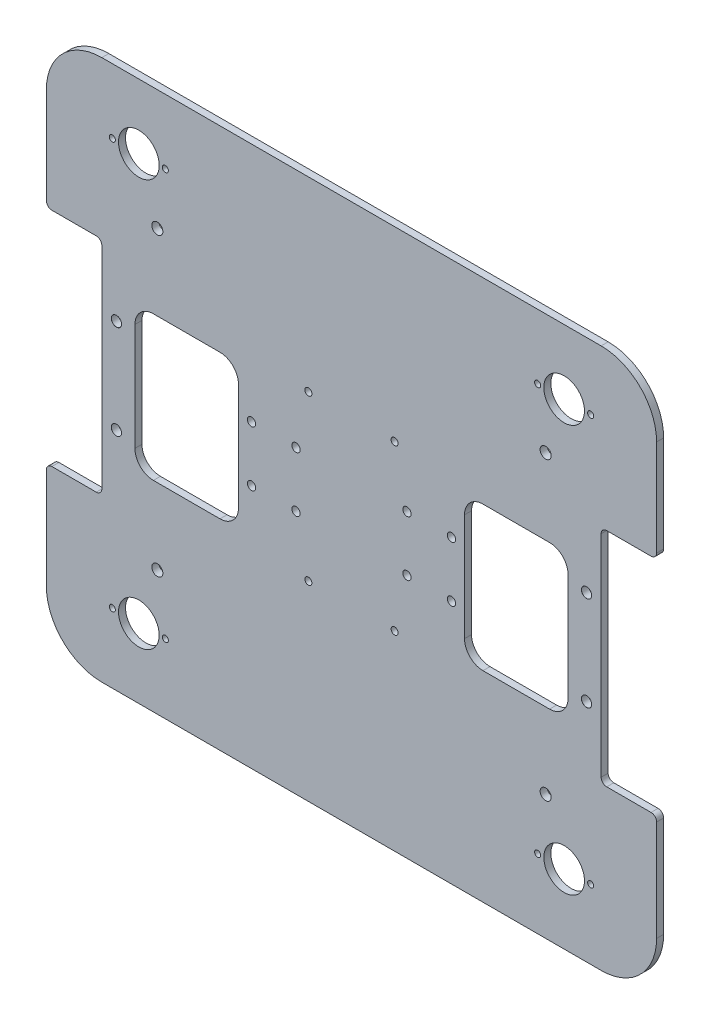
from build123d import *

# Parameters (mm, degrees)
SKETCH2_R                      = 1.65
SKETCH2_R_2                    = 11
SKETCH2_R_3                    = 3
SKETCH2_R_4                    = 1.9
SKETCH2_R_5                    = 2.25
BOSS_EXTRUDE1_DEPTH            = 3.8
M5_CLEARANCE_HOLE1_D           = 5.5
M5_CLEARANCE_HOLE1_CSINK_D     = 5.55
M5_CLEARANCE_HOLE1_CSINK_ANGLE = 90
SKETCH4_R                      = 13.987722527
BOSS_EXTRUDE2_DEPTH            = 0.2


with BuildPart() as part:
    # Sketch2 → Boss-Extrude1 (new body)
    with BuildSketch(Plane.XY):
        with BuildLine():
            Line((165, 63), (165, 115))
            ThreePointArc((165, 115), (156.213203436, 136.213203436), (135, 145))
            Line((135, 145), (71.563974327, 145))
            Line((71.563974327, 145), (-71.563974327, 145))
            Line((-71.563974327, 145), (-135, 145))
            ThreePointArc((-135, 145), (-156.213203436, 136.213203436), (-165, 115))
            Line((-165, 115), (-165, 63))
            ThreePointArc((-165, 63), (-164.121320344, 60.878679656), (-162, 60))
            Line((-162, 60), (-138, 60))
            ThreePointArc((-138, 60), (-135.878679656, 59.121320344), (-135, 57))
            Line((-135, 57), (-135, -57))
            ThreePointArc((-135, -57), (-135.878679656, -59.121320344), (-138, -60))
            Line((-138, -60), (-162, -60))
            ThreePointArc((-162, -60), (-164.121320344, -60.878679656), (-165, -63))
            Line((-165, -63), (-165, -117.5))
            ThreePointArc((-165, -117.5), (-156.213203436, -138.713203436), (-135, -147.5))
            Line((-135, -147.5), (135, -147.5))
            ThreePointArc((135, -147.5), (156.213203436, -138.713203436), (165, -117.5))
            Line((165, -117.5), (165, -63))
            ThreePointArc((165, -63), (164.121320344, -60.878679656), (162, -60))
            Line((162, -60), (138, -60))
            ThreePointArc((138, -60), (135.878679656, -59.121320344), (135, -57))
            Line((135, -57), (135, 57))
            ThreePointArc((135, 57), (135.878679656, 59.121320344), (138, 60))
            Line((138, 60), (162, 60))
            ThreePointArc((162, 60), (164.121320344, 60.878679656), (165, 63))
        make_face()
        with Locations(Location((-129.334802826, -110, 0), (0, 0, 180))):
            Circle(SKETCH2_R, mode=Mode.SUBTRACT)
        with Locations(Location((-115, -110, 0), (0, 0, 180))):
            Circle(SKETCH2_R_2, mode=Mode.SUBTRACT)
        with Locations(Location((-100.665197174, -110, 0), (0, 0, 180))):
            Circle(SKETCH2_R, mode=Mode.SUBTRACT)
        with Locations(Location((-105, -80, 0), (0, 0, 180))):
            Circle(SKETCH2_R_3, mode=Mode.SUBTRACT)
        with Locations(Location((-127.121259344, -25.5, 0), (0, 0, 180))):
            Circle(SKETCH2_R, mode=Mode.SUBTRACT)
        with Locations(Location((-23.312977745, -44.325601579, 0), (0, 0, 180))):
            Circle(SKETCH2_R_4, mode=Mode.SUBTRACT)
        with Locations(Location((-54.06, -14.995, 0), (0, 0, 180))):
            Circle(SKETCH2_R_5, mode=Mode.SUBTRACT)
        with Locations(Location((-30, -14.995, 0), (0, 0, 180))):
            Circle(SKETCH2_R_5, mode=Mode.SUBTRACT)
        with Locations(Location((100.665197174, -110, 0), (0, 0, 180))):
            Circle(SKETCH2_R, mode=Mode.SUBTRACT)
        with Locations(Location((115, -110, 0), (0, 0, 180))):
            Circle(SKETCH2_R_2, mode=Mode.SUBTRACT)
        with Locations(Location((105, -80, 0), (0, 0, 180))):
            Circle(SKETCH2_R_3, mode=Mode.SUBTRACT)
        with Locations(Location((129.334802826, -110, 0), (0, 0, 180))):
            Circle(SKETCH2_R, mode=Mode.SUBTRACT)
        with Locations(Location((23.312977745, -44.325601579, 0), (0, 0, 180))):
            Circle(SKETCH2_R_4, mode=Mode.SUBTRACT)
        with Locations(Location((30, -14.995, 0), (0, 0, 180))):
            Circle(SKETCH2_R_5, mode=Mode.SUBTRACT)
        with Locations(Location((54.06, -14.995, 0), (0, 0, 180))):
            Circle(SKETCH2_R_5, mode=Mode.SUBTRACT)
        with Locations(Location((127.121259344, -25.5, 0), (0, 0, 180))):
            Circle(SKETCH2_R, mode=Mode.SUBTRACT)
        with Locations(Location((-127.121259344, 25.5, 0), (0, 0, 180))):
            Circle(SKETCH2_R, mode=Mode.SUBTRACT)
        with BuildLine():
            ThreePointArc((-117.12, 28.95), (-114.191067812, 36.021067812), (-107.12, 38.95))
            Line((-107.12, 38.95), (-71.12, 38.95))
            ThreePointArc((-71.12, 38.95), (-64.048932188, 36.021067812), (-61.12, 28.95))
            Line((-61.12, 28.95), (-61.12, -29.05))
            ThreePointArc((-61.12, -29.05), (-64.048932188, -36.121067812), (-71.12, -39.05))
            Line((-71.12, -39.05), (-107.12, -39.05))
            ThreePointArc((-107.12, -39.05), (-114.191067812, -36.121067812), (-117.12, -29.05))
            Line((-117.12, -29.05), (-117.12, 28.95))
        make_face(mode=Mode.SUBTRACT)
        with Locations(Location((-54.06, 14.895, 0), (0, 0, 180))):
            Circle(SKETCH2_R_5, mode=Mode.SUBTRACT)
        with Locations(Location((-30, 14.895, 0), (0, 0, 180))):
            Circle(SKETCH2_R_5, mode=Mode.SUBTRACT)
        with Locations(Location((-23.312977745, 44.325601579, 0), (0, 0, 180))):
            Circle(SKETCH2_R_4, mode=Mode.SUBTRACT)
        with Locations(Location((-105, 80, 0), (0, 0, 180))):
            Circle(SKETCH2_R_3, mode=Mode.SUBTRACT)
        with Locations(Location((-129.334802826, 110, 0), (0, 0, 180))):
            Circle(SKETCH2_R, mode=Mode.SUBTRACT)
        with Locations(Location((-115, 110, 0), (0, 0, 180))):
            Circle(SKETCH2_R_2, mode=Mode.SUBTRACT)
        with Locations(Location((-100.665197174, 110, 0), (0, 0, 180))):
            Circle(SKETCH2_R, mode=Mode.SUBTRACT)
        with Locations(Location((30, 14.895, 0), (0, 0, 180))):
            Circle(SKETCH2_R_5, mode=Mode.SUBTRACT)
        with Locations(Location((54.06, 14.895, 0), (0, 0, 180))):
            Circle(SKETCH2_R_5, mode=Mode.SUBTRACT)
        with Locations(Location((23.312977745, 44.325601579, 0), (0, 0, 180))):
            Circle(SKETCH2_R_4, mode=Mode.SUBTRACT)
        with BuildLine():
            Line((61.12, -29.05), (61.12, 28.95))
            ThreePointArc((61.12, 28.95), (64.048932188, 36.021067812), (71.12, 38.95))
            Line((71.12, 38.95), (107.12, 38.95))
            ThreePointArc((107.12, 38.95), (114.191067812, 36.021067812), (117.12, 28.95))
            Line((117.12, 28.95), (117.12, -29.05))
            ThreePointArc((117.12, -29.05), (114.191067812, -36.121067812), (107.12, -39.05))
            Line((107.12, -39.05), (71.12, -39.05))
            ThreePointArc((71.12, -39.05), (64.048932188, -36.121067812), (61.12, -29.05))
        make_face(mode=Mode.SUBTRACT)
        with Locations(Location((127.121259344, 25.5, 0), (0, 0, 180))):
            Circle(SKETCH2_R, mode=Mode.SUBTRACT)
        with Locations(Location((105, 80, 0), (0, 0, 180))):
            Circle(SKETCH2_R_3, mode=Mode.SUBTRACT)
        with Locations(Location((100.665197174, 110, 0), (0, 0, 180))):
            Circle(SKETCH2_R, mode=Mode.SUBTRACT)
        with Locations(Location((115, 110, 0), (0, 0, 180))):
            Circle(SKETCH2_R_2, mode=Mode.SUBTRACT)
        with Locations(Location((129.334802826, 110, 0), (0, 0, 180))):
            Circle(SKETCH2_R, mode=Mode.SUBTRACT)
    extrude(amount=BOSS_EXTRUDE1_DEPTH)

    # M5 Clearance Hole1 (through all)
    with Locations(Plane(origin=(-127.121259344, 25.5, 3.8), x_dir=(1, 0, 0), z_dir=(0, 0, 1))):
        with Locations((0, 0), (0, -51), (254.242518688, -51), (254.242518688, 0)):
            CounterSinkHole(M5_CLEARANCE_HOLE1_D / 2, M5_CLEARANCE_HOLE1_CSINK_D / 2, counter_sink_angle=M5_CLEARANCE_HOLE1_CSINK_ANGLE)

    # Sketch4 → Boss-Extrude2 (add)
    with BuildSketch(Plane(origin=(0, 0, 0), x_dir=(-1, 0, 0), z_dir=(0, 0, -1))):
        with Locations(Location((-0.021137242, 0, 0), (0, 0, 180))):
            Circle(SKETCH4_R)
    extrude(amount=BOSS_EXTRUDE2_DEPTH)


solid = part.part
